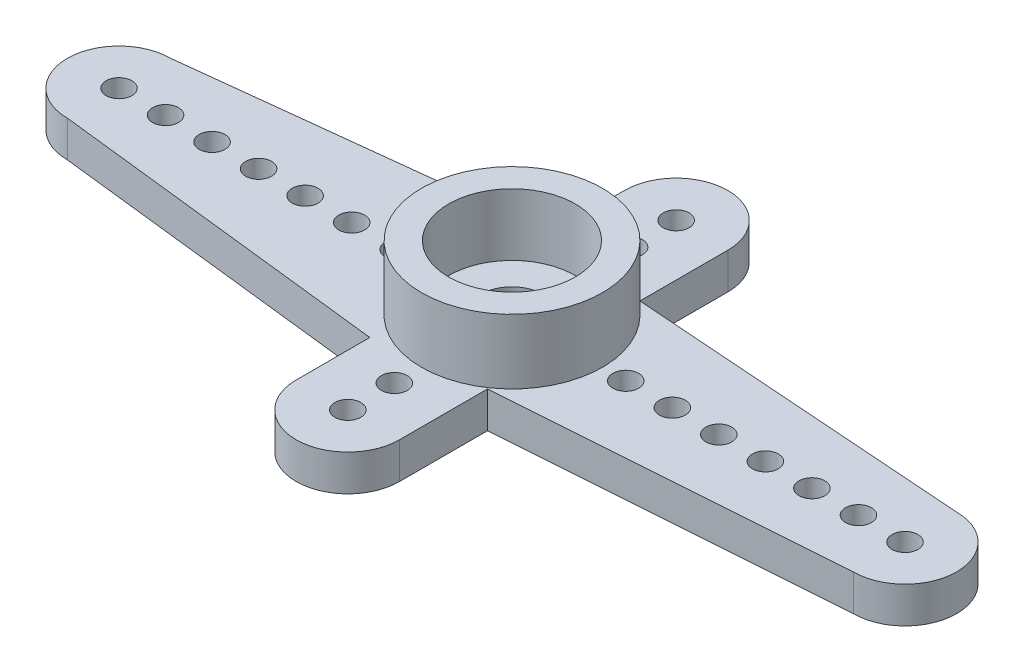
from build123d import *

# Parameters (mm, degrees)
SKETCH1_R           = 0.5
BOSS_EXTRUDE1_DEPTH = 1.4
SKETCH2_R           = 2.35
CUT_EXTRUDE1_DEPTH  = 1
SKETCH3_R           = 3.5
SKETCH3_R_2         = 2.45
BOSS_EXTRUDE2_DEPTH = 2.5
SKETCH4_R           = 1.2
CUT_EXTRUDE2_DEPTH  = 20.282440198
SKETCH5_R           = 2.45
SKETCH5_R_2         = 1.2
BOSS_EXTRUDE3_DEPTH = 0.1
SKETCH6_W           = 35.735260114
SKETCH6_H           = 17.672039004
CUT_EXTRUDE4_DEPTH  = 20.513392837
CUT_EXTRUDE5_DEPTH  = 18.980545042
CIRPATTERN2_COUNT   = 2
SKETCH9_R           = 1.2
CUT_EXTRUDE6_DEPTH  = 20.282440198


with BuildPart() as part:
    # Sketch1 → Boss-Extrude1 (new body)
    with BuildSketch(Plane(origin=(0, 0, 0), x_dir=(1, 0, 0), z_dir=(0, 1, 0))):
        with BuildLine():
            Line((-15.2, 2), (-2, 2.95))
            Line((-2, 2.95), (-2, 6.35))
            ThreePointArc((-2, 6.35), (0, 8.35), (2, 6.35))
            Line((2, 6.35), (2, 3.5))
            Line((2, 3.5), (15.2, 2))
            ThreePointArc((15.2, 2), (17.2, 0), (15.2, -2))
            Line((15.2, -2), (2, -3.5))
            Line((2, -3.5), (2, -6.35))
            ThreePointArc((2, -6.35), (0, -8.35), (-2, -6.35))
            Line((-2, -6.35), (-2, -2.95))
            Line((-2, -2.95), (-15.2, -2))
            ThreePointArc((-15.2, -2), (-17.2, 0), (-15.2, 2))
        make_face()
        with Locations(Location((0, 6.35, 0), (0, 0, 270))):
            Circle(SKETCH1_R, mode=Mode.SUBTRACT)
        with Locations(Location((0, 4.55, 0), (0, 0, 270))):
            Circle(SKETCH1_R, mode=Mode.SUBTRACT)
        with Locations(Location((0, -4.55, 0), (0, 0, 90))):
            Circle(SKETCH1_R, mode=Mode.SUBTRACT)
        with Locations(Location((0, -6.35, 0), (0, 0, 90))):
            Circle(SKETCH1_R, mode=Mode.SUBTRACT)
        with Locations(Location((-15.2, 0, 0), (0, 0, 270))):
            Circle(SKETCH1_R, mode=Mode.SUBTRACT)
        with Locations(Location((15.2, 0, 0), (0, 0, 270))):
            Circle(SKETCH1_R, mode=Mode.SUBTRACT)
        with Locations(Location((-13.4, 0, 0), (0, 0, 270))):
            Circle(SKETCH1_R, mode=Mode.SUBTRACT)
        with Locations(Location((-11.6, 0, 0), (0, 0, 270))):
            Circle(SKETCH1_R, mode=Mode.SUBTRACT)
        with Locations(Location((-9.8, 0, 0), (0, 0, 270))):
            Circle(SKETCH1_R, mode=Mode.SUBTRACT)
        with Locations(Location((-8, 0, 0), (0, 0, 270))):
            Circle(SKETCH1_R, mode=Mode.SUBTRACT)
        with Locations(Location((-6.2, 0, 0), (0, 0, 270))):
            Circle(SKETCH1_R, mode=Mode.SUBTRACT)
        with Locations(Location((-4.4, 0, 0), (0, 0, 270))):
            Circle(SKETCH1_R, mode=Mode.SUBTRACT)
        with Locations(Location((13.4, 0, 0), (0, 0, 270))):
            Circle(SKETCH1_R, mode=Mode.SUBTRACT)
        with Locations(Location((11.6, 0, 0), (0, 0, 270))):
            Circle(SKETCH1_R, mode=Mode.SUBTRACT)
        with Locations(Location((9.8, 0, 0), (0, 0, 270))):
            Circle(SKETCH1_R, mode=Mode.SUBTRACT)
        with Locations(Location((8, 0, 0), (0, 0, 270))):
            Circle(SKETCH1_R, mode=Mode.SUBTRACT)
        with Locations(Location((6.2, 0, 0), (0, 0, 270))):
            Circle(SKETCH1_R, mode=Mode.SUBTRACT)
        with Locations(Location((4.4, 0, 0), (0, 0, 270))):
            Circle(SKETCH1_R, mode=Mode.SUBTRACT)
    boss_extrude1 = extrude(amount=BOSS_EXTRUDE1_DEPTH)

    # Sketch2 → Cut-Extrude1 (cut)
    with BuildSketch(Plane.XZ):
        with Locations(Location((0, 0, 0), (0, 0, 270))):
            Circle(SKETCH2_R)
    extrude(amount=-CUT_EXTRUDE1_DEPTH, mode=Mode.SUBTRACT)

    # Sketch3 → Boss-Extrude2 (add)
    with BuildSketch(Plane(origin=(0, 1.4, 0), x_dir=(1, 0, 0), z_dir=(0, 1, 0))):
        with Locations(Location((0, 0, 0), (0, 0, 270))):
            Circle(SKETCH3_R)
        with Locations(Location((0, 0, 0), (0, 0, 270))):
            Circle(SKETCH3_R_2, mode=Mode.SUBTRACT)
    extrude(amount=BOSS_EXTRUDE2_DEPTH)

    # Sketch4 → Cut-Extrude2 (cut, through all)
    with BuildSketch(Plane(origin=(0, 1.4, 0), x_dir=(1, 0, 0), z_dir=(0, 1, 0))):
        with Locations(Location((0, 0, 0), (0, 0, 270))):
            Circle(SKETCH4_R)
    extrude(amount=-CUT_EXTRUDE2_DEPTH, mode=Mode.SUBTRACT)

    # Sketch5 → Boss-Extrude3 (add)
    with BuildSketch(Plane(origin=(0, 1.4, 0), x_dir=(1, 0, 0), z_dir=(0, 1, 0))):
        with Locations(Location((0, 0, 0), (0, 0, 270))):
            Circle(SKETCH5_R)
        with Locations(Location((0, 0, 0), (0, 0, 270))):
            Circle(SKETCH5_R_2, mode=Mode.SUBTRACT)
    extrude(amount=BOSS_EXTRUDE3_DEPTH)

    # Sketch6 → Cut-Extrude4 (cut, through all)
    with BuildSketch(Plane.XZ):
        Rectangle(SKETCH6_W, SKETCH6_H)
        with BuildLine():
            Line((-1.868584713, -2.959457918), (-15.2, -2))
            ThreePointArc((-15.2, -2), (-17.2, 0), (-15.2, 2))
            Line((-15.2, 2), (-1.868584713, 2.959457918))
            ThreePointArc((-1.868584713, 2.959457918), (0, 3.5), (1.868584713, 2.959457918))
            Line((1.868584713, 2.959457918), (15.2, 2))
            ThreePointArc((15.2, 2), (17.2, 0), (15.2, -2))
            Line((15.2, -2), (1.868584713, -2.959457918))
            ThreePointArc((1.868584713, -2.959457918), (0, -3.5), (-1.868584713, -2.959457918))
        make_face(mode=Mode.SUBTRACT)
    extrude(amount=-CUT_EXTRUDE4_DEPTH, mode=Mode.SUBTRACT)

    # Sketch7 → Cut-Extrude5 (cut, through all)
    with BuildSketch(Plane.XZ):
        with BuildLine():
            Line((0, 3.5), (-17.731768104, 3.5))
            Line((-17.731768104, 3.5), (-17.731768104, -3.5))
            Line((-17.731768104, -3.5), (0, -3.5))
            ThreePointArc((0, -3.5), (-3.5, 0), (0, 3.5))
        make_face()
    extrude(amount=-CUT_EXTRUDE5_DEPTH, mode=Mode.SUBTRACT)

    # CirPattern2: Boss-Extrude1 ×2 about axis
    cirpattern2_axis = Axis((0, 0, 0), (0, 1, 0))
    for i in range(1, CIRPATTERN2_COUNT):
        add(boss_extrude1.rotate(cirpattern2_axis, i * 360 / CIRPATTERN2_COUNT))

    # Sketch9 → Cut-Extrude6 (cut, through all)
    with BuildSketch(Plane(origin=(0, 1.4, 0), x_dir=(1, 0, 0), z_dir=(0, 1, 0))):
        with Locations(Location((0, 0, 0), (0, 0, 270))):
            Circle(SKETCH9_R)
    extrude(amount=-CUT_EXTRUDE6_DEPTH, mode=Mode.SUBTRACT)


solid = part.part
